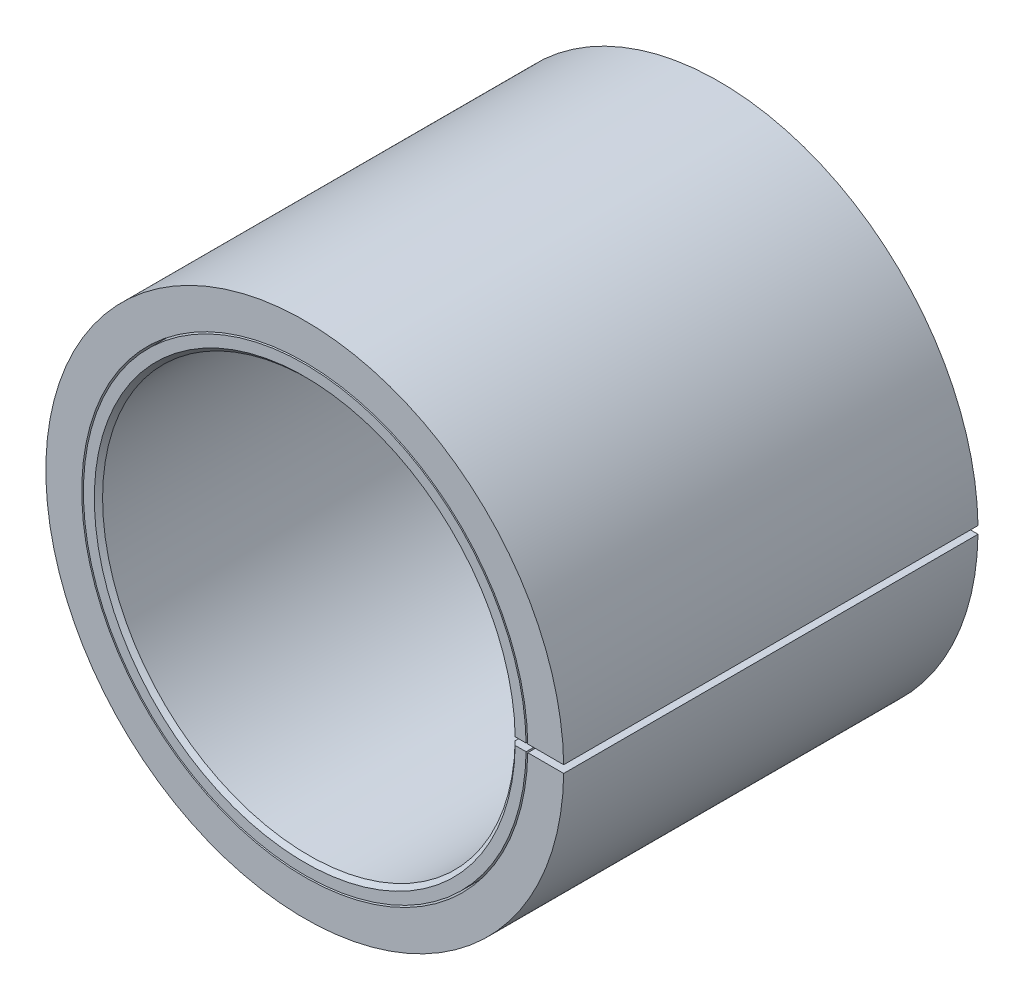
from build123d import *

# Parameters (mm, degrees)
BOSS_EXTRUDE1_DEPTH          = 3.175
BOSS_EXTRUDE1_DEPTH_BACK     = 3.175
SKETCH3_R                    = 3.96875
SKETCH3_R_2                  = 3.1623
SKETCH4_R                    = 3.418114286
SKETCH4_R_2                  = 3.392714286
CUT_EXTRUDE_THIN1_DEPTH      = 9.474930863
CHAMFER1_SIZE                = 0.063246
CUT_EXTRUDE_THIN3_DEPTH      = 9.474930863
CUT_EXTRUDE_THIN3_DEPTH_BACK = 9.474930863
SKETCH5_W                    = 4.053825817
SKETCH5_H                    = 0.115207142


with BuildPart() as part:
    # Sketch3 → Boss-Extrude1 (new, two sides: drawn at the far end of the back side and taken through both)
    with BuildSketch(Plane.XY.offset(-BOSS_EXTRUDE1_DEPTH_BACK)):
        Circle(SKETCH3_R)
        Circle(SKETCH3_R_2, mode=Mode.SUBTRACT)
    extrude(amount=BOSS_EXTRUDE1_DEPTH + BOSS_EXTRUDE1_DEPTH_BACK)

    # Sketch4 → Cut-Extrude-Thin1 (cut, through all)
    with BuildSketch(Plane.XY.offset(3.175)):
        Circle(SKETCH4_R)
        Circle(SKETCH4_R_2, mode=Mode.SUBTRACT)
    extrude(amount=-CUT_EXTRUDE_THIN1_DEPTH, mode=Mode.SUBTRACT)


with BuildPart() as cut_extrude_thin1_piece_1:
    # of the separate pieces the step leaves, piece 1, a body of its own (cut_extrude_thin1_pieces)
    add(part.part.solids().sort_by_distance((3.96875, 0, 0))[0])


with BuildPart() as cut_extrude_thin1_piece_2:
    # of the separate pieces the step leaves, piece 2, a body of its own (cut_extrude_thin1_pieces)
    add(part.part.solids().sort_by_distance((3.392714286, 0, 3.175))[0])

    # Chamfer1
    chamfer1_edges = [cut_extrude_thin1_piece_2.edges().sort_by_distance(p)[0] for p in [
        (-3.1623, 0, -3.175),
        (-3.1623, 0, 3.175),
    ]]
    chamfer(chamfer1_edges, length=CHAMFER1_SIZE)


with BuildPart() as cut_extrude_thin3_tool:
    # Sketch5 → Cut-Extrude-Thin3 (new, two sides: drawn at the far end of the back side and taken through both)
    with BuildSketch(Plane.XY.offset(3.175).offset(-CUT_EXTRUDE_THIN3_DEPTH_BACK)):
        with Locations((2.026912908, 0)):
            Rectangle(SKETCH5_W, SKETCH5_H)
    extrude(amount=CUT_EXTRUDE_THIN3_DEPTH + CUT_EXTRUDE_THIN3_DEPTH_BACK)


with BuildPart() as cut_extrude_thin1_piece_1_1:
    add(cut_extrude_thin1_piece_1.part)

    # Cut-Extrude-Thin3: cut by cut_extrude_thin3_tool
    add(cut_extrude_thin3_tool.part, mode=Mode.SUBTRACT)


with BuildPart() as cut_extrude_thin1_piece_2_1:
    add(cut_extrude_thin1_piece_2.part)

    # Cut-Extrude-Thin3: cut by cut_extrude_thin3_tool
    add(cut_extrude_thin3_tool.part, mode=Mode.SUBTRACT)


solid = Compound([cut_extrude_thin1_piece_1_1.part, cut_extrude_thin1_piece_2_1.part])
